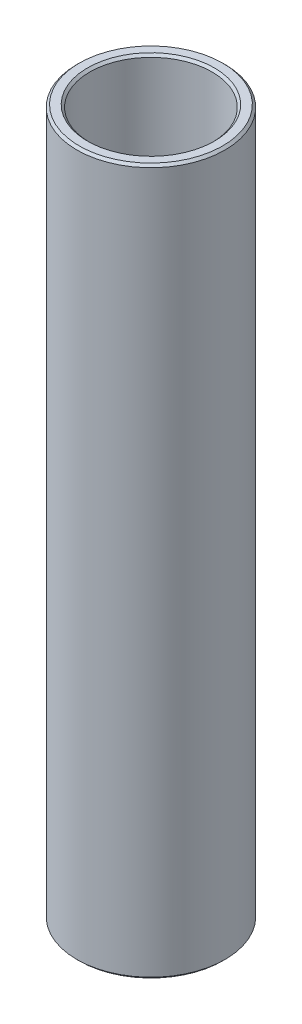
from build123d import *

# Parameters (mm, degrees)
SKETCH1_W     = 0.7
SKETCH1_H     = 38.1
CHAMFER1_SIZE = 0.127


with BuildPart() as part:
    # Sketch1 → Revolve1 (revolve)
    with BuildSketch(Plane.XY, mode=Mode.PRIVATE) as revolve1_sk:
        with Locations((3.65, 0)):
            Rectangle(SKETCH1_W, SKETCH1_H)
    revolve(revolve1_sk.sketch.rotate(Axis((0, 7.406764361, 0), (0, -1, 0)), 90), axis=Axis((0, 7.406764361, 0), (0, -1, 0)))

    # Chamfer1
    chamfer1_edges = [part.edges().sort_by_distance(p)[0] for p in [
        (0, 19.05, -4),
        (0, -19.05, -4),
        (0, -19.05, -3.3),
        (0, 19.05, -3.3),
    ]]
    chamfer(chamfer1_edges, length=CHAMFER1_SIZE)


solid = part.part
